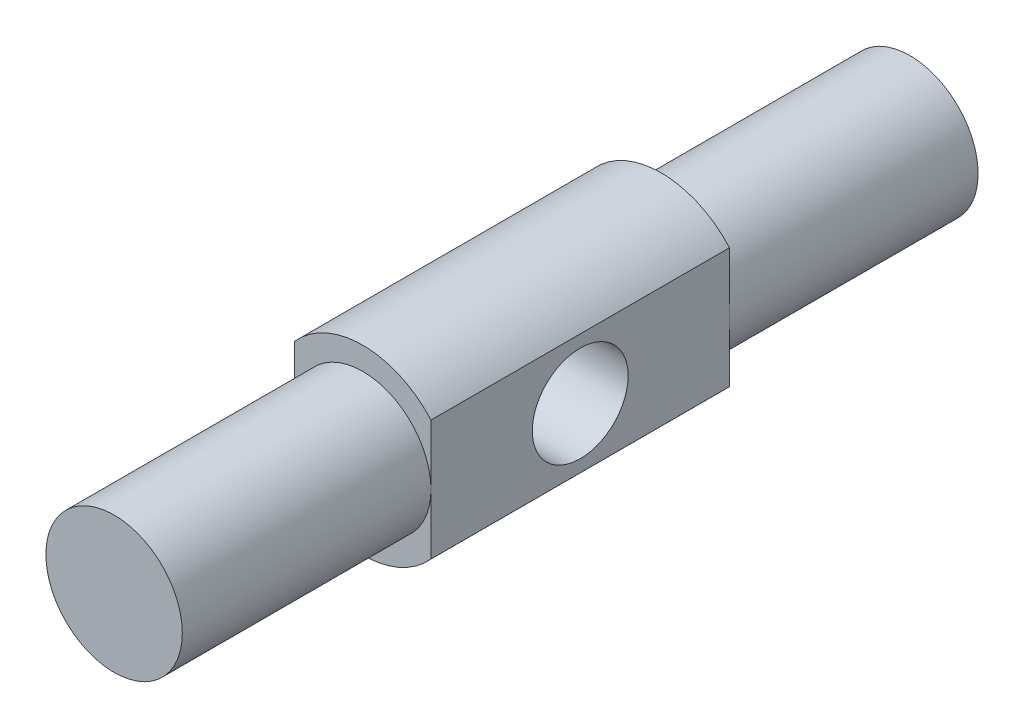
from build123d import *

# Parameters (mm, degrees)
SKETCH2_R           = 6
BOSS_EXTRUDE2_DEPTH = 70
CUT_EXTRUDE1_DEPTH  = 21.875
CUT_EXTRUDE3_START  = -21.875
CUT_EXTRUDE3_DEPTH  = 21.875
SKETCH4_R           = 4.215
CUT_EXTRUDE4_DEPTH  = 72.470273541


with BuildPart() as part:
    # Sketch2 → Boss-Extrude2 (new body)
    with BuildSketch(Plane.XY):
        with BuildLine():
            ThreePointArc((-6, 0), (0, 6), (6, 0))
            Line((6, 0), (6, 5.291502622))
            ThreePointArc((6, 5.291502622), (0, 8), (-6, 5.291502622))
            Line((-6, 5.291502622), (-6, 0))
        make_face()
        Circle(SKETCH2_R)
        with BuildLine():
            Line((6, -5.291502622), (6, 0))
            ThreePointArc((6, 0), (0, -6), (-6, 0))
            Line((-6, 0), (-6, -5.291502622))
            ThreePointArc((-6, -5.291502622), (0, -8), (6, -5.291502622))
        make_face()
    extrude(amount=-BOSS_EXTRUDE2_DEPTH)

    # Sketch5 → Cut-Extrude1 (cut)
    with BuildSketch(Plane.XY):
        with BuildLine():
            ThreePointArc((6, 5.291502622), (0, 8), (-6, 5.291502622))
            Line((-6, 5.291502622), (-6, -5e-09))
            ThreePointArc((-6, -5e-09), (-2e-09, 6), (6, 0))
            Line((6, 0), (6, 5.291502622))
        make_face()
        with BuildLine():
            ThreePointArc((6, 0), (2e-09, -6), (-6, -5e-09))
            Line((-6, -5e-09), (-6, -5.291502622))
            ThreePointArc((-6, -5.291502622), (0, -8), (6, -5.291502622))
            Line((6, -5.291502622), (6, 0))
        make_face()
    extrude(amount=-CUT_EXTRUDE1_DEPTH, mode=Mode.SUBTRACT)

    # Sketch6 → Cut-Extrude3 (cut)
    with BuildSketch(Plane(origin=(0, 0, -70), x_dir=(-1, 0, 0), z_dir=(0, 0, -1)).offset(CUT_EXTRUDE3_START)):
        with BuildLine():
            ThreePointArc((6, 5.291502622), (0, 8), (-6, 5.291502622))
            Line((-6, 5.291502622), (-6, -5e-09))
            ThreePointArc((-6, -5e-09), (-2e-09, 6), (6, 0))
            Line((6, 0), (6, 5.291502622))
        make_face()
        with BuildLine():
            ThreePointArc((6, 0), (2e-09, -6), (-6, -5e-09))
            Line((-6, -5e-09), (-6, -5.291502622))
            ThreePointArc((-6, -5.291502622), (0, -8), (6, -5.291502622))
            Line((6, -5.291502622), (6, 0))
        make_face()
    extrude(amount=CUT_EXTRUDE3_DEPTH, mode=Mode.SUBTRACT)

    # Sketch4 → Cut-Extrude4 (cut, through all)
    with BuildSketch(Plane(origin=(6, 0, 0), x_dir=(0, 0, -1), z_dir=(1, 0, 0))):
        with Locations((35, 0)):
            Circle(SKETCH4_R)
    extrude(amount=-CUT_EXTRUDE4_DEPTH, mode=Mode.SUBTRACT)


solid = part.part
